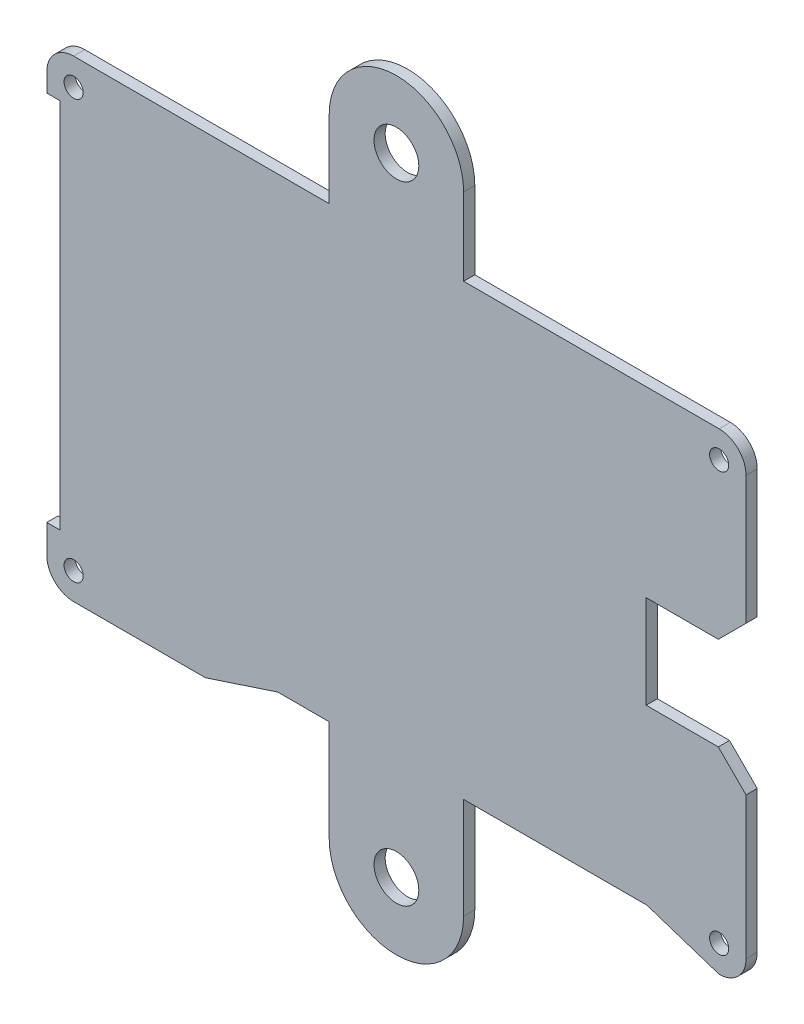
from build123d import *

# Parameters (mm, degrees)
SKETCH1_R           = 1.355900406
BOSS_EXTRUDE1_DEPTH = 1.5875
SKETCH2_R           = 3.175
BOSS_EXTRUDE2_DEPTH = 1.5875


with BuildPart() as part:
    # Sketch1 → Boss-Extrude1 (new body)
    with BuildSketch(Plane.XY):
        with BuildLine():
            Line((-301.9473, 111.74645), (-305.87795, 115.6771))
            Line((-305.87795, 115.6771), (-316.1078, 115.6771))
            Line((-316.1078, 115.6771), (-316.1078, 128.8851))
            Line((-316.1078, 128.8851), (-305.87795, 128.8851))
            Line((-305.87795, 128.8851), (-301.9473, 132.81575))
            Line((-301.9473, 132.81575), (-301.9473, 150.9704))
            ThreePointArc((-301.9473, 150.9704), (-303.063223164, 153.664476836), (-305.7573, 154.7804))
            Line((-305.7573, 154.7804), (-397.247125, 154.7804))
            ThreePointArc((-397.247125, 154.7804), (-399.946077222, 153.659592612), (-401.0571, 150.956597849))
            Line((-401.0571, 150.956597849), (-401.0571, 148.341))
            Line((-401.0571, 148.341), (-399.1521, 148.341))
            Line((-399.1521, 148.341), (-399.1521, 95.6449))
            Line((-399.1521, 95.6449), (-401.0571, 95.6449))
            Line((-401.0571, 95.6449), (-401.0571, 91.659304166))
            ThreePointArc((-401.0571, 91.659304166), (-399.951018769, 88.947400452), (-397.2472, 87.8217))
            Line((-397.2472, 87.8217), (-378.5565, 87.8217))
            Line((-378.5565, 87.8217), (-368.3165, 91.1883))
            Line((-368.3165, 91.1883), (-315.9973, 91.1883))
            Line((-315.9973, 91.1883), (-305.7573, 87.8217))
            ThreePointArc((-305.7573, 87.8217), (-303.063223164, 88.937623164), (-301.9473, 91.6317))
            Line((-301.9473, 91.6317), (-301.9473, 111.74645))
        make_face()
        with Locations((-305.7573, 91.6317)):
            Circle(SKETCH1_R, mode=Mode.SUBTRACT)
        with Locations((-305.7573, 150.9704)):
            Circle(SKETCH1_R, mode=Mode.SUBTRACT)
        with Locations((-397.247125, 150.9704)):
            Circle(SKETCH1_R, mode=Mode.SUBTRACT)
        with Locations((-397.2472, 91.6317)):
            Circle(SKETCH1_R, mode=Mode.SUBTRACT)
    extrude(amount=BOSS_EXTRUDE1_DEPTH)

    # Sketch2 → Boss-Extrude2 (add)
    # profile 1 of 2: a face of its own
    with BuildSketch(Plane.XY.offset(1.5875)):
        with BuildLine():
            Line((-361.0272, 165.75105), (-361.0272, 154.7804))
            Line((-361.0272, 154.7804), (-341.9772, 154.7804))
            Line((-341.9772, 154.7804), (-341.9772, 165.75105))
            ThreePointArc((-341.9772, 165.75105), (-351.5022, 175.27605), (-361.0272, 165.75105))
        make_face()
        with Locations((-351.5022, 165.75105)):
            Circle(SKETCH2_R, mode=Mode.SUBTRACT)
    # profile 2 of 2: a face of its own
    with BuildSketch(Plane.XY.offset(1.5875)):
        with BuildLine():
            Line((-341.9772, 91.1883), (-361.0272, 91.1883))
            Line((-361.0272, 91.1883), (-361.0272, 76.85105))
            ThreePointArc((-361.0272, 76.85105), (-351.5022, 67.32605), (-341.9772, 76.85105))
            Line((-341.9772, 76.85105), (-341.9772, 91.1883))
        make_face()
        with Locations((-351.5022, 76.85105)):
            Circle(SKETCH2_R, mode=Mode.SUBTRACT)
    extrude(amount=-BOSS_EXTRUDE2_DEPTH)


solid = part.part
